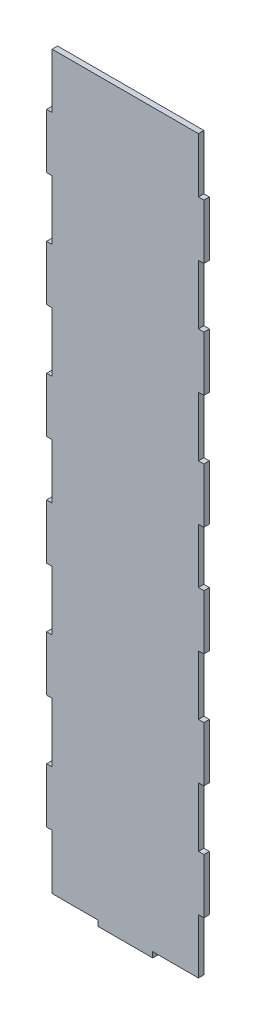
from build123d import *

# Parameters (mm, degrees)
RESSALTO_EXTRUS_O1_DEPTH = 3
CORTE_EXTRUS_O3_DEPTH    = 219.215489826
ESBO_O4_W                = 3
ESBO_O4_H                = 30
RESSALTO_EXTRUS_O3_DEPTH = 3


with BuildPart() as part:
    # Esboço1 → Ressalto-extrusão1 (new body)
    with BuildSketch(Plane.XY):
        Polygon((-80, -200), (-55, -200), (-55, -203), (-25, -203), (-25, -200), (25, -200), (25, -203), (55, -203), (55, -200), (80, -200), (80, 200), (-80, 200), align=None)
    extrude(amount=RESSALTO_EXTRUS_O1_DEPTH)

    # Esboço2 → Corte-extrusão3 (cut, through all)
    with BuildSketch(Plane.XY.offset(3)):
        Polygon((0, 200), (0, 170), (3, 170), (3, 140), (0, 140), (0, 107.5), (3, 107.5), (3, 77.5), (0, 77.5), (0, 45), (3, 45), (3, 15), (0, 15), (0, -15), (3, -15), (3, -45), (0, -45), (0, -77.5), (3, -77.5), (3, -107.5), (0, -107.5), (0, -140), (3, -140), (3, -170), (0, -170), (0, -200), (25, -200), (25, -203), (55, -203), (55, -200), (80, -200), (80, 200), align=None)
    extrude(amount=-CORTE_EXTRUS_O3_DEPTH, mode=Mode.SUBTRACT)

    # Esboço4 → Ressalto-extrusão3 (add)
    with BuildSketch(Plane.XY.offset(3)):
        with Locations((-81.5, 155)):
            Rectangle(ESBO_O4_W, ESBO_O4_H)
        with Locations((-81.5, 92.5)):
            Rectangle(ESBO_O4_W, ESBO_O4_H)
        with Locations((-81.5, 30)):
            Rectangle(ESBO_O4_W, ESBO_O4_H)
        with Locations((-81.5, -30)):
            Rectangle(ESBO_O4_W, ESBO_O4_H)
        with Locations((-81.5, -92.5)):
            Rectangle(ESBO_O4_W, ESBO_O4_H)
        with Locations((-81.5, -155)):
            Rectangle(ESBO_O4_W, ESBO_O4_H)
    extrude(amount=-RESSALTO_EXTRUS_O3_DEPTH)


solid = part.part
